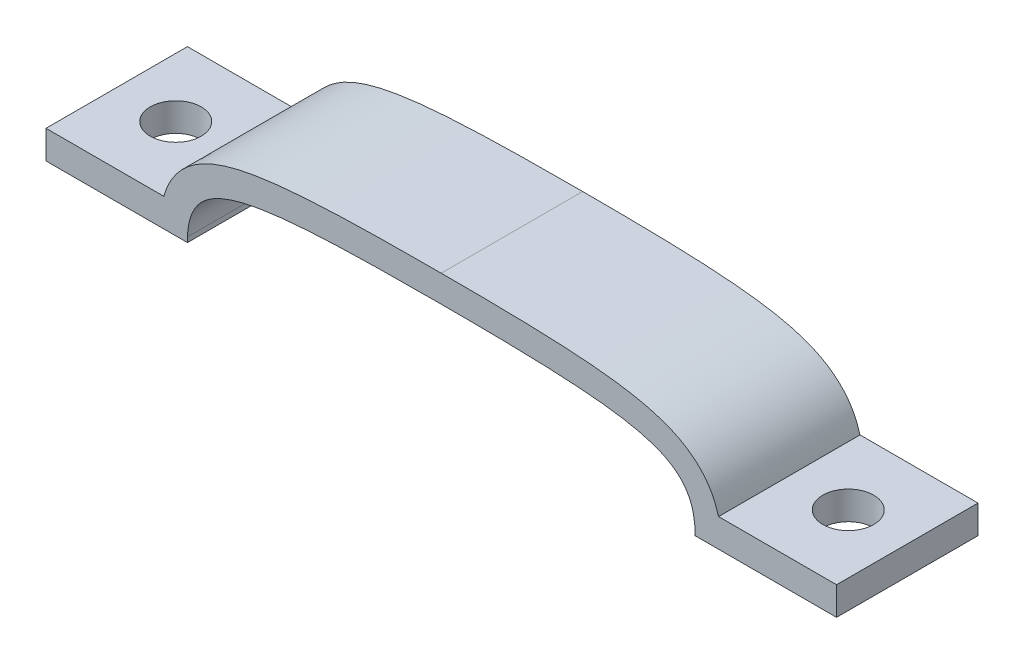
from build123d import *

# Parameters (mm, degrees)
BOSS_EXTRUDE1_DEPTH  = 10
M3_CLEARANCE_HOLE1_D = 3.6


with BuildPart() as part:
    # Sketch1 → Boss-Extrude1 (new body)
    with BuildSketch(Plane.XY):
        with BuildLine():
            Line((-60.071865843, 158.433944586), (-60.071865843, 158.086868585))
            Line((-60.071865843, 158.086868585), (-70.071865843, 158.086868585))
            Line((-70.071865843, 158.086868585), (-70.071865843, 160.086868585))
            Line((-70.071865843, 160.086868585), (-61.737611418, 160.086868585))
            add(Edge.make_bspline(
                [(-42.129225527, 165.186859626), (-42.977807037, 165.186859988), (-44.678224484, 165.181933225), (-47.209231367, 165.150882075), (-49.74192012, 165.081555264), (-52.291038411, 164.945937503), (-54.455080713, 164.731497457), (-56.255120817, 164.418028105), (-57.665212852, 164.04941281), (-59.182648793, 163.43388964), (-60.511128599, 162.437445588), (-61.327648426, 161.2280062), (-61.606787874, 160.536587134), (-61.716531582, 160.164036641), (-61.737611418, 160.086868585)],
                knots=[0.500001245, 0.500001245, 0.500001245, 0.500001245, 0.531356832, 0.562712419, 0.594068006, 0.625423593, 0.65677918, 0.672456974, 0.688134768, 0.703812561, 0.719490355, 0.727329251, 0.73479101, 0.736750735, 0.736750735, 0.736750735, 0.736750735], degree=3))
            add(Edge.make_bspline(
                [(-22.520839316, 160.086868585), (-22.542398925, 160.165792032), (-22.607754881, 160.387078464), (-22.804535541, 160.930325251), (-23.22358028, 161.725143028), (-23.947982988, 162.553558881), (-25.005259277, 163.370103577), (-26.347129003, 163.971682922), (-27.802457078, 164.375196309), (-29.206218405, 164.632537516), (-30.56094003, 164.805515449), (-32.338448656, 164.966218974), (-34.514502554, 165.081677345), (-37.085705755, 165.151738274), (-39.62785294, 165.182162424), (-41.292958253, 165.186859644), (-42.129225527, 165.186859626)],
                knots=[0.772781141, 0.772781141, 0.772781141, 0.772781141, 0.77469393, 0.778116543, 0.785767697, 0.793418851, 0.801070004, 0.816372312, 0.831674619, 0.846976926, 0.862279234, 0.877581541, 0.908186156, 0.938790771, 0.969395385, 0.999999989, 0.999999989, 0.999999989, 0.999999989], degree=3))
            Line((-22.520839316, 160.086868585), (-14.179226419, 160.086868585))
            Line((-14.179226419, 160.086868585), (-14.179226419, 158.086868585))
            Line((-14.179226419, 158.086868585), (-24.179226419, 158.086868585))
            add(Edge.make_bspline(
                [(-24.179226419, 158.086868585), (-24.17922642, 158.52341786), (-24.235684401, 159.39201048), (-24.738163757, 160.685431171), (-25.761907783, 161.618567296), (-26.968792465, 162.167965525), (-28.219863194, 162.51977654), (-29.913292178, 162.830153249), (-32.039454707, 163.046674526), (-34.586679577, 163.183060856), (-37.120592622, 163.251933888), (-39.640089694, 163.282196609), (-41.297668845, 163.286859645), (-42.129226426, 163.286859626)],
                knots=[0.755163082, 0.755163082, 0.755163082, 0.755163082, 0.77046539, 0.785767697, 0.801070004, 0.816372312, 0.831674619, 0.846976926, 0.877581541, 0.908186156, 0.938790771, 0.969395385, 1, 1, 1, 1], degree=3))
            add(Edge.make_bspline(
                [(-42.129226426, 163.286859626), (-43.810516811, 163.286860342), (-46.346669536, 163.273840815), (-49.670813728, 163.182542922), (-52.157685802, 163.050705666), (-54.633540161, 162.800940146), (-56.687823673, 162.397641303), (-58.265533161, 161.746859791), (-59.321589807, 160.931865013), (-59.947005957, 159.721222926), (-60.052734865, 158.863750442), (-60.071865843, 158.433944586)],
                knots=[0.500001245, 0.500001245, 0.500001245, 0.500001245, 0.562726434, 0.594089029, 0.625451624, 0.656814219, 0.688176814, 0.703858111, 0.719539409, 0.735220706, 0.750902004, 0.750902004, 0.750902004, 0.750902004], degree=3))
        make_face()
    extrude(amount=BOSS_EXTRUDE1_DEPTH)

    # M3 Clearance Hole1 (through all)
    with Locations(Plane(origin=(0, 158.086868585, 0), x_dir=(-1, 0, 0), z_dir=(0, -1, 0))):
        with Locations((18.350032933, -5), (65.90105946, -5)):
            Hole(M3_CLEARANCE_HOLE1_D / 2)


solid = part.part
